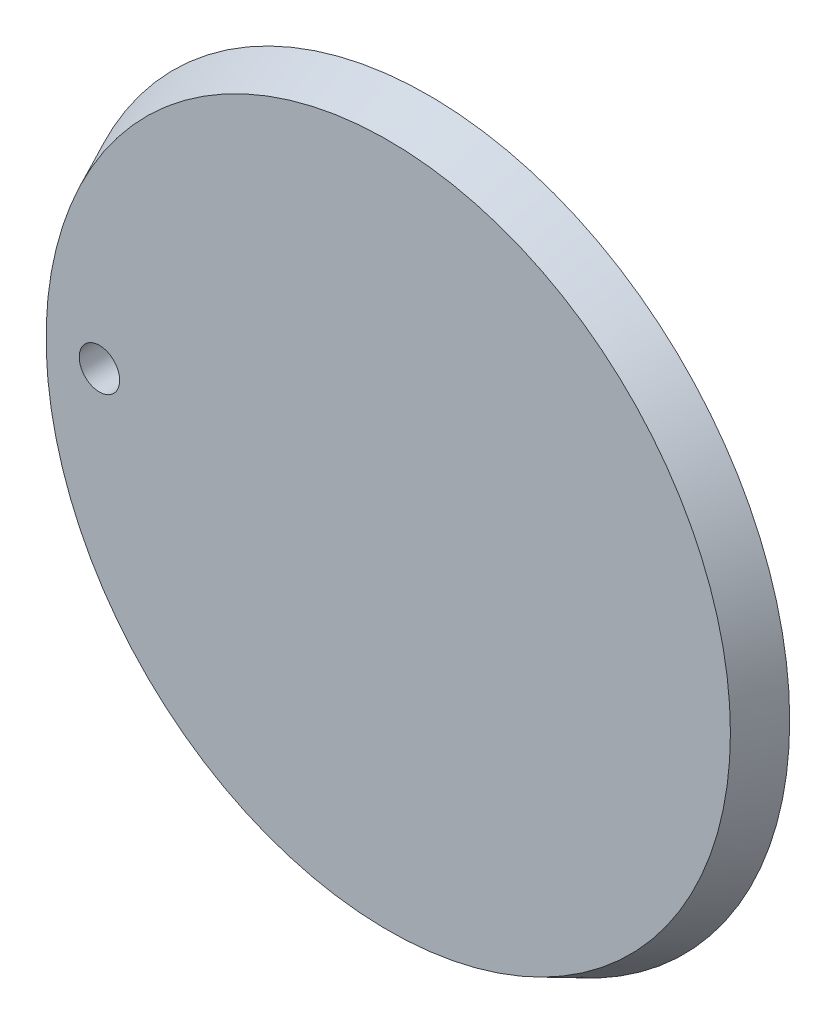
from build123d import *

# Parameters (mm, degrees)
BOSS_EXTRUDE2_DEPTH      = 10
BOSS_EXTRUDE2_DEPTH_BACK = 14
SKETCH2_R                = 25
SKETCH4_R                = 62.5
BOSS_EXTRUDE3_DEPTH      = 7
BOSS_EXTRUDE3_TAPER      = 25
SKETCH6_R                = 3.5
CUT_EXTRUDE2_DEPTH       = 5


with BuildPart() as part:
    # Sketch2 → Boss-Extrude2 (new, two sides: drawn at the far end of the back side and taken through both)
    with BuildSketch(Plane.XY.offset(-BOSS_EXTRUDE2_DEPTH_BACK)):
        Circle(SKETCH2_R)
    extrude(amount=BOSS_EXTRUDE2_DEPTH + BOSS_EXTRUDE2_DEPTH_BACK)

    # Sketch4 → Boss-Extrude3 (add)
    with BuildSketch(Plane.XY.offset(10)):
        Circle(SKETCH4_R)
    extrude(amount=BOSS_EXTRUDE3_DEPTH, taper=BOSS_EXTRUDE3_TAPER)

    # Sketch6 → Cut-Extrude2 (cut)
    with BuildSketch(Plane.XY.offset(17)):
        with Locations((-50, 0)):
            Circle(SKETCH6_R)
    extrude(amount=-CUT_EXTRUDE2_DEPTH, mode=Mode.SUBTRACT)


solid = part.part
